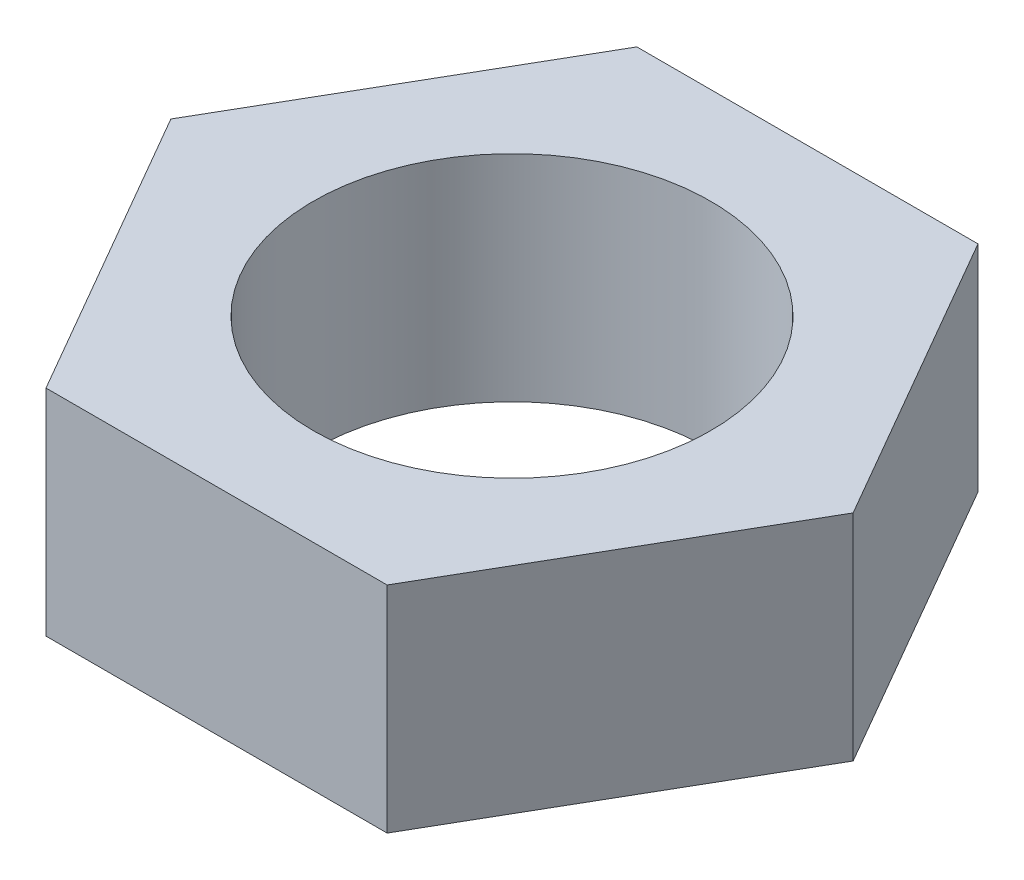
from build123d import *

# Parameters (mm, degrees)
SKETCH1_R           = 1.85
BOSS_EXTRUDE1_DEPTH = 2


with BuildPart() as part:
    # Sketch1 → Boss-Extrude1 (new body)
    with BuildSketch(Plane(origin=(0, 0, 0), x_dir=(1, 0, 0), z_dir=(0, 1, 0))):
        Polygon((3.175426481, 0), (1.58771324, 2.75), (-1.58771324, 2.75), (-3.175426481, 0), (-1.58771324, -2.75), (1.58771324, -2.75), align=None)
        with Locations(Location((0, 0, 0), (0, 0, 270))):
            Circle(SKETCH1_R, mode=Mode.SUBTRACT)
    extrude(amount=BOSS_EXTRUDE1_DEPTH)


solid = part.part
